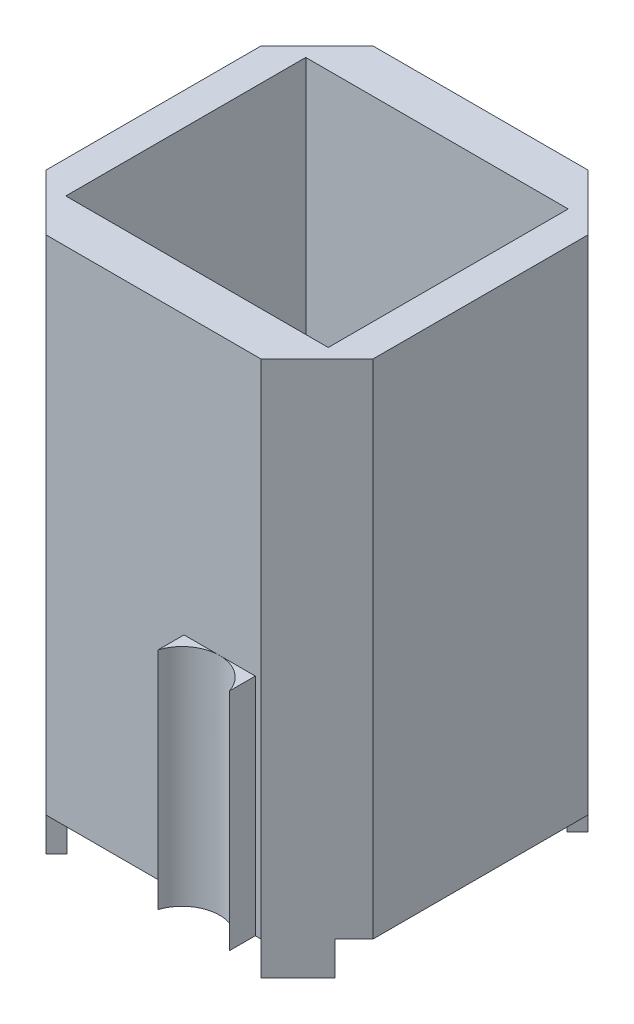
from build123d import *

# Parameters (mm, degrees)
SKETCH_1_W          = 35
SKETCH_1_H          = 32
EXTRUDE_1_DEPTH     = 65
EXTRUDE_2_DEPTH     = 2
SKETCH_2_R          = 1
CUT_EXTRUDE_1_DEPTH = 74.759079051
SKETCH_3_R          = 2
CUT_EXTRUDE_2_DEPTH = 1
EXTRUDE_3_DEPTH     = 4.5
EXTRUDE_4_DEPTH     = 30


with BuildPart() as part:
    # Эскиз1 → Бобышка-Вытянуть1 (new body)
    with BuildSketch(Plane(origin=(0, 0, 0), x_dir=(1, 0, 0), z_dir=(0, 1, 0))):
        Polygon((-14.328756252, 21.811189745), (-21.809945997, 14.33), (-21.809945997, -14.33), (-14.328756252, -21.811189745), (14.328756252, -21.811189745), (21.809945997, -14.33), (21.809945997, 14.33), (14.328756252, 21.811189745), align=None)
        Rectangle(SKETCH_1_W, SKETCH_1_H, mode=Mode.SUBTRACT)
    extrude(amount=EXTRUDE_1_DEPTH)

    # Эскиз1<3> → Бобышка-Вытянуть2 (add)
    with BuildSketch(Plane(origin=(0, 0, 0), x_dir=(1, 0, 0), z_dir=(0, 1, 0))):
        Polygon((-14.328756252, 21.811189745), (-21.809945997, 14.33), (-21.809945997, -14.33), (-14.328756252, -21.811189745), (14.328756252, -21.811189745), (21.809945997, -14.33), (21.809945997, 14.33), (14.328756252, 21.811189745), align=None)
    extrude(amount=-EXTRUDE_2_DEPTH)

    # Эскиз2 → Вырез-Вытянуть1 (cut, through all)
    with BuildSketch(Plane.XZ.offset(2)):
        with Locations((-3.809945997, 8)):
            Circle(SKETCH_2_R)
        with Locations((-3.809945997, -8)):
            Circle(SKETCH_2_R)
    extrude(amount=-CUT_EXTRUDE_1_DEPTH, mode=Mode.SUBTRACT)

    # Эскиз3 → Вырез-Вытянуть2 (cut)
    with BuildSketch(Plane(origin=(0, 0, 0), x_dir=(1, 0, 0), z_dir=(0, 1, 0))):
        with Locations((-3.809945997, 8)):
            Circle(SKETCH_3_R)
        with Locations((-3.809945997, -8)):
            Circle(SKETCH_3_R)
    extrude(amount=-CUT_EXTRUDE_2_DEPTH, mode=Mode.SUBTRACT)

    # Эскиз4 → Бобышка-Вытянуть3 (add)
    with BuildSketch(Plane.XZ.offset(2)):
        Polygon((-14.328756252, 21.811189745), (-19.27850372, 16.861442277), (-17.864290158, 15.447228714), (-12.91454269, 20.396976183), align=None)
        Polygon((19.27850372, 16.861442277), (14.328756252, 21.811189745), (12.91454269, 20.396976183), (17.864290158, 15.447228714), align=None)
        Polygon((12.91454269, -20.396976183), (14.328756252, -21.811189745), (19.27850372, -16.861442277), (17.864290158, -15.447228714), align=None)
        Polygon((-17.864290158, -15.447228714), (-19.27850372, -16.861442277), (-14.328756252, -21.811189745), (-12.91454269, -20.396976183), align=None)
    extrude(amount=EXTRUDE_3_DEPTH)

    # Эскиз5 → Бобышка-Вытянуть4 (add)
    with BuildSketch(Plane.XZ.offset(2)):
        with BuildLine():
            ThreePointArc((8.828756252, 21.811189745), (5.891921221, 22.764586231), (4.075073469, 25.261189745))
            Line((4.075073469, 25.261189745), (4.075073469, 21.811189745))
            Line((4.075073469, 21.811189745), (8.828756252, 21.811189745))
        make_face()
        with BuildLine():
            ThreePointArc((13.582439035, 25.261189745), (11.765591283, 22.764586231), (8.828756252, 21.811189745))
            Line((8.828756252, 21.811189745), (13.582439035, 21.811189745))
            Line((13.582439035, 21.811189745), (13.582439035, 25.261189745))
        make_face()
    extrude(amount=-EXTRUDE_4_DEPTH)


solid = part.part
